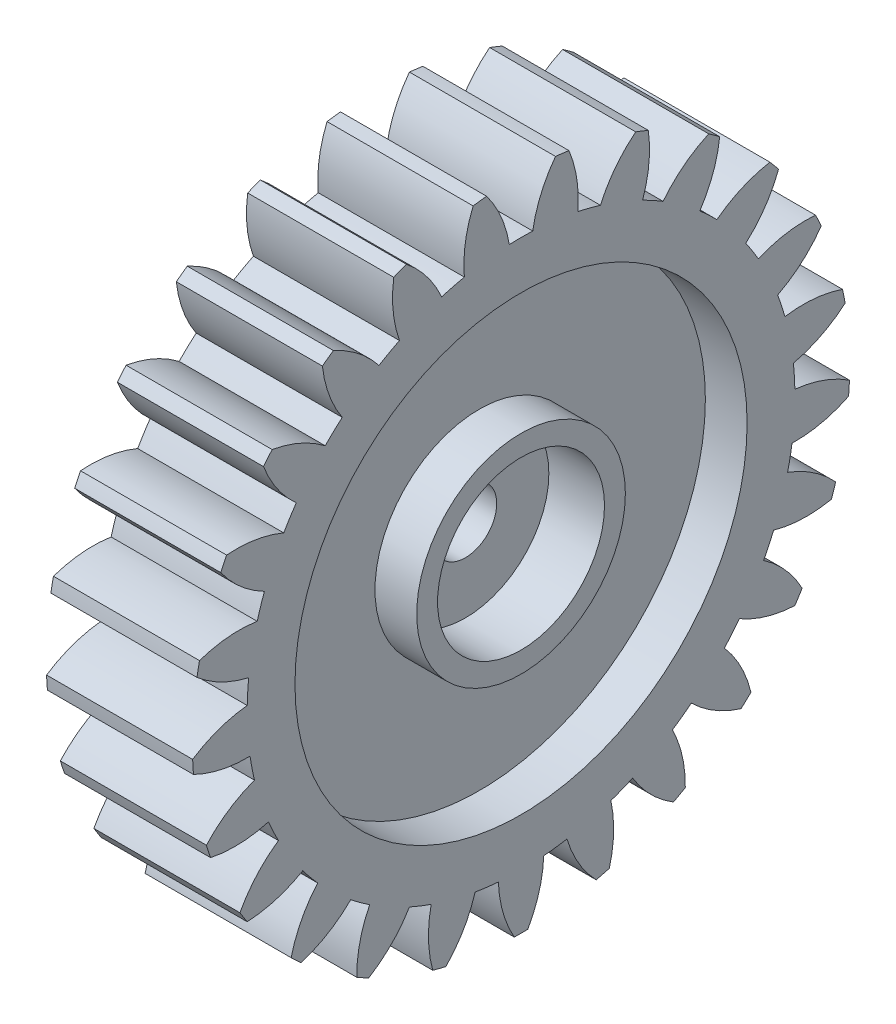
from build123d import *

# Parameters (mm, degrees)
BASPROSKE_W        = 4.2
BASPROSKE_H        = 9.45
TOOTHCUT_DEPTH     = 15.008747267
TEETHCUTS_COUNT    = 25
TEETHCUTS_ANGLE    = 345.6
SKETCH7_R          = 2.4
CUT_EXTRUDE2_DEPTH = 1.6
SKETCH13_R         = 6.5
SKETCH13_R_2       = 3
CUT_EXTRUDE3_DEPTH = 1.2
CUT_EXTRUDE4_START = -1.2
SKETCH15_R         = 6.5
SKETCH15_R_2       = 3
CUT_EXTRUDE4_DEPTH = 1.2
CUT_EXTRUDE5_START = -1.6
SKETCH17_R         = 2.4
CUT_EXTRUDE5_DEPTH = 1.6
SKETCH18_R         = 0.9
CUT_EXTRUDE6_DEPTH = 1.6


with BuildPart() as part:
    # BasProSke → Base-Revolve (revolve)
    with BuildSketch(Plane(origin=(0, 0, 0), x_dir=(1, 0, 0), z_dir=(0, 1, 0)), mode=Mode.PRIVATE) as base_revolve_sk:
        with Locations((2.1, 4.725)):
            Rectangle(BASPROSKE_W, BASPROSKE_H)
    revolve(base_revolve_sk.sketch.rotate(Axis((-10, 0, 0), (1, 0, 0)), 180), axis=Axis((-10, 0, 0), (1, 0, 0)))

    # TooCutSke → ToothCut (cut, through all)
    with BuildSketch(Plane(origin=(0, 0, 0), x_dir=(0, 0, -1), z_dir=(1, 0, 0))):
        with BuildLine():
            ThreePointArc((0.336642775, 7.866800343), (0, 7.874), (-0.336642775, 7.866800343))
            ThreePointArc((-0.336642775, 7.866800343), (-0.577188207, 8.685445672), (-1.008672355, 9.421559597))
            ThreePointArc((-1.008672355, 9.421559597), (0, 9.4754), (1.008672355, 9.421559597))
            ThreePointArc((1.008672355, 9.421559597), (0.577188207, 8.685445672), (0.336642775, 7.866800343))
        make_face()
    toothcut = extrude(amount=TOOTHCUT_DEPTH, mode=Mode.SUBTRACT)

    # TeethCuts: ToothCut ×25 about axis
    teethcuts_axis = Axis((-10, 0, 0), (1, 0, 0))
    for i in range(1, TEETHCUTS_COUNT):
        add(toothcut.rotate(teethcuts_axis, i * TEETHCUTS_ANGLE / (TEETHCUTS_COUNT - 1)), mode=Mode.SUBTRACT)

    # Sketch7 → Cut-Extrude2 (cut)
    with BuildSketch(Plane(origin=(4.2, 0, 0), x_dir=(0, 0, -1), z_dir=(1, 0, 0))):
        Circle(SKETCH7_R)
    extrude(amount=-CUT_EXTRUDE2_DEPTH, mode=Mode.SUBTRACT)

    # Sketch13 → Cut-Extrude3 (cut)
    with BuildSketch(Plane(origin=(4.2, 0, 0), x_dir=(0, 0, -1), z_dir=(1, 0, 0))):
        Circle(SKETCH13_R)
        Circle(SKETCH13_R_2, mode=Mode.SUBTRACT)
    extrude(amount=-CUT_EXTRUDE3_DEPTH, mode=Mode.SUBTRACT)

    # Sketch15 → Cut-Extrude4 (cut)
    with BuildSketch(Plane.ZY.offset(CUT_EXTRUDE4_START)):
        with Locations(Location((0, 0, 0), (0, 0, 180))):
            Circle(SKETCH15_R)
        with Locations(Location((0, 0, 0), (0, 0, 180))):
            Circle(SKETCH15_R_2, mode=Mode.SUBTRACT)
    extrude(amount=CUT_EXTRUDE4_DEPTH, mode=Mode.SUBTRACT)

    # Sketch17 → Cut-Extrude5 (cut)
    with BuildSketch(Plane.ZY.offset(CUT_EXTRUDE5_START)):
        with Locations(Location((0, 0, 0), (0, 0, 180))):
            Circle(SKETCH17_R)
    extrude(amount=CUT_EXTRUDE5_DEPTH, mode=Mode.SUBTRACT)

    # Sketch18 → Cut-Extrude6 (cut)
    with BuildSketch(Plane(origin=(2.6, 0, 0), x_dir=(0, 0, -1), z_dir=(1, 0, 0))):
        Circle(SKETCH18_R)
    extrude(amount=-CUT_EXTRUDE6_DEPTH, mode=Mode.SUBTRACT)


solid = part.part
